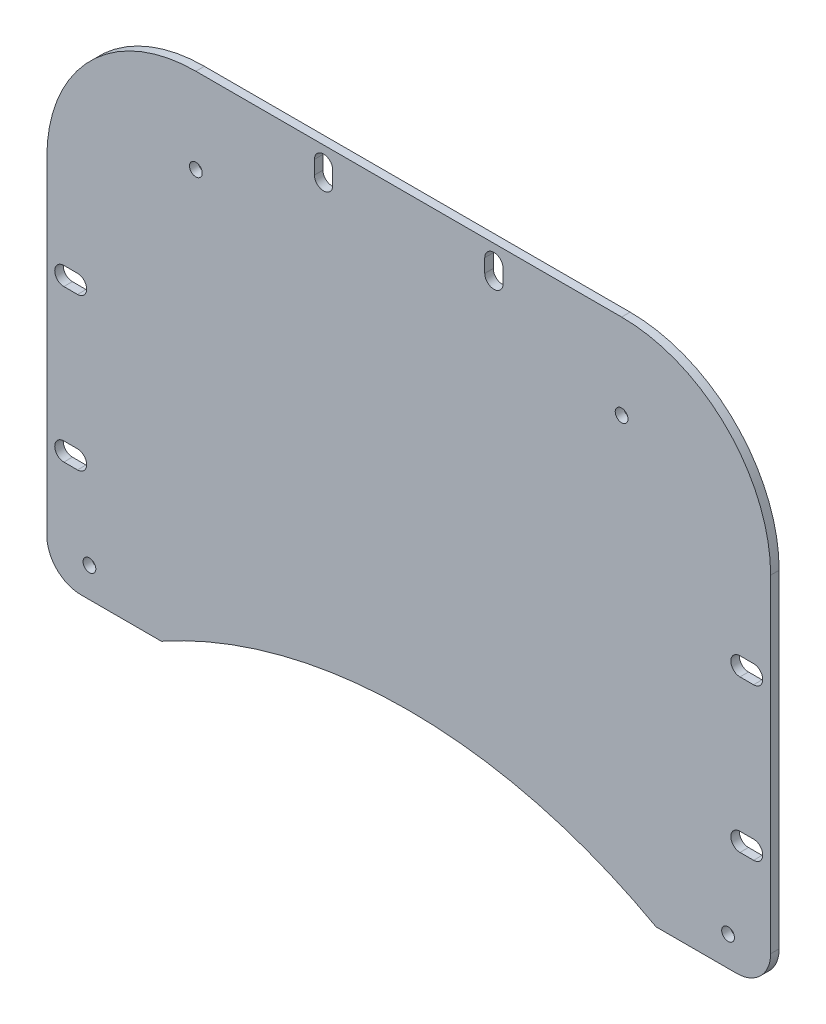
from build123d import *

# Parameters (mm, degrees)
SKETCH1_R           = 1.5
BOSS_EXTRUDE1_DEPTH = 2
FILLET1_R           = 8


with BuildPart() as part:
    # Sketch1 → Boss-Extrude1 (new body)
    with BuildSketch(Plane.XY):
        with BuildLine():
            Line((85, 40), (85, -45))
            Line((85, -45), (58.094750193, -45))
            ThreePointArc((58.094750193, -45), (0, -30), (-58.094750193, -45))
            Line((-58.094750193, -45), (-85, -45))
            Line((-85, -45), (-85, 40))
            ThreePointArc((-85, 40), (-74.748737342, 64.748737342), (-50, 75))
            Line((-50, 75), (50, 75))
            ThreePointArc((50, 75), (74.748737342, 64.748737342), (85, 40))
        make_face()
        with Locations((50, 55)):
            Circle(SKETCH1_R, mode=Mode.SUBTRACT)
        with Locations((-75, -38)):
            Circle(SKETCH1_R, mode=Mode.SUBTRACT)
        with Locations((75, -38)):
            Circle(SKETCH1_R, mode=Mode.SUBTRACT)
        with Locations((-50, 55)):
            Circle(SKETCH1_R, mode=Mode.SUBTRACT)
        with BuildLine():
            ThreePointArc((-22.15, 67.8), (-20, 65.65), (-17.85, 67.8))
            Line((-17.85, 67.8), (-17.85, 71))
            ThreePointArc((-17.85, 71), (-20, 73.15), (-22.15, 71))
            Line((-22.15, 71), (-22.15, 67.8))
        make_face(mode=Mode.SUBTRACT)
        with BuildLine():
            Line((81, 15.701693023), (77.8, 15.701693023))
            ThreePointArc((77.8, 15.701693023), (75.651693023, 17.85), (77.8, 19.998306977))
            Line((77.8, 19.998306977), (81, 19.998306977))
            ThreePointArc((81, 19.998306977), (83.148306977, 17.85), (81, 15.701693023))
        make_face(mode=Mode.SUBTRACT)
        with BuildLine():
            Line((-81, -15.701693023), (-77.8, -15.701693023))
            ThreePointArc((-77.8, -15.701693023), (-75.651693023, -17.85), (-77.8, -19.998306977))
            Line((-77.8, -19.998306977), (-81, -19.998306977))
            ThreePointArc((-81, -19.998306977), (-83.148306977, -17.85), (-81, -15.701693023))
        make_face(mode=Mode.SUBTRACT)
        with BuildLine():
            ThreePointArc((-77.8, 15.701693023), (-75.651693023, 17.85), (-77.8, 19.998306977))
            Line((-77.8, 19.998306977), (-81, 19.998306977))
            ThreePointArc((-81, 19.998306977), (-83.148306977, 17.85), (-81, 15.701693023))
            Line((-81, 15.701693023), (-77.8, 15.701693023))
        make_face(mode=Mode.SUBTRACT)
        with BuildLine():
            ThreePointArc((77.8, -15.701693023), (75.651693023, -17.85), (77.8, -19.998306977))
            Line((77.8, -19.998306977), (81, -19.998306977))
            ThreePointArc((81, -19.998306977), (83.148306977, -17.85), (81, -15.701693023))
            Line((81, -15.701693023), (77.8, -15.701693023))
        make_face(mode=Mode.SUBTRACT)
        with BuildLine():
            Line((22.15, 71), (22.15, 67.8))
            ThreePointArc((22.15, 67.8), (20, 65.65), (17.85, 67.8))
            Line((17.85, 67.8), (17.85, 71))
            ThreePointArc((17.85, 71), (20, 73.15), (22.15, 71))
        make_face(mode=Mode.SUBTRACT)
    extrude(amount=BOSS_EXTRUDE1_DEPTH)

    # Fillet1
    fillet1_edges = [part.edges().sort_by_distance(p)[0] for p in [
        (85, -45, 1),
        (-85, -45, 1),
    ]]
    fillet(fillet1_edges, radius=FILLET1_R)


solid = part.part
